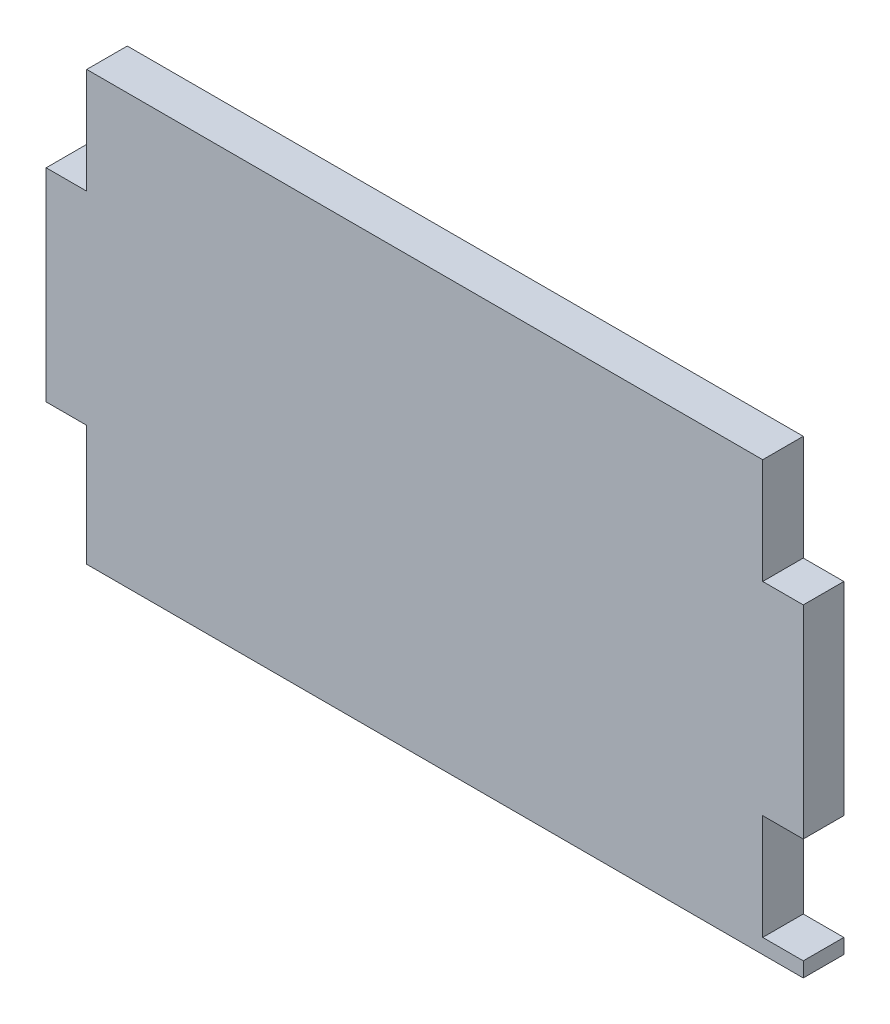
from build123d import *

# Parameters (mm, degrees)
SKETCH1_W           = 56
SKETCH1_H           = 31.7
BOSS_EXTRUDE1_DEPTH = 3
SKETCH2_W           = 3
SKETCH2_H           = 7.8
CUT_EXTRUDE1_DEPTH  = 45.306907356
LPATTERN1_COUNT     = 2
LPATTERN1_PITCH     = 22.8
SKETCH3_W           = 3
SKETCH3_H           = 7.8
CUT_EXTRUDE2_DEPTH  = 45.306907356
LPATTERN2_COUNT     = 4
LPATTERN2_PITCH     = 22.8
SKETCH6_W           = 3
SKETCH6_H           = 1.1
CUT_EXTRUDE3_DEPTH  = 10


with BuildPart() as part:
    # Sketch1 → Boss-Extrude1 (new body)
    with BuildSketch(Plane.XY):
        with Locations((-12.993460648, 0.692013889)):
            Rectangle(SKETCH1_W, SKETCH1_H)
    extrude(amount=BOSS_EXTRUDE1_DEPTH)

    # Sketch2 → Cut-Extrude1 (cut, through all)
    with BuildSketch(Plane.XY.offset(3)):
        with Locations((-39.493460648, 12.642013889)):
            Rectangle(SKETCH2_W, SKETCH2_H)
    cut_extrude1 = extrude(amount=-CUT_EXTRUDE1_DEPTH, mode=Mode.SUBTRACT)

    # LPattern1: Cut-Extrude1 ×2
    with Locations(*[(0, -i * LPATTERN1_PITCH, 0) for i in range(1, LPATTERN1_COUNT)]):
        add(cut_extrude1, mode=Mode.SUBTRACT)

    # Sketch3 → Cut-Extrude2 (cut, through all)
    with BuildSketch(Plane.XY.offset(3)):
        with Locations((13.506539352, 12.642013889)):
            Rectangle(SKETCH3_W, SKETCH3_H)
    cut_extrude2 = extrude(amount=-CUT_EXTRUDE2_DEPTH, mode=Mode.SUBTRACT)

    # LPattern2: Cut-Extrude2 ×4
    with Locations(*[(0, -i * LPATTERN2_PITCH, 0) for i in range(1, LPATTERN2_COUNT)]):
        add(cut_extrude2, mode=Mode.SUBTRACT)

    # Sketch6 → Cut-Extrude3 (cut)
    with BuildSketch(Plane.XY.offset(3)):
        with Locations((-39.493460648, -14.607986111)):
            Rectangle(SKETCH6_W, SKETCH6_H)
    extrude(amount=-CUT_EXTRUDE3_DEPTH, mode=Mode.SUBTRACT)


solid = part.part
